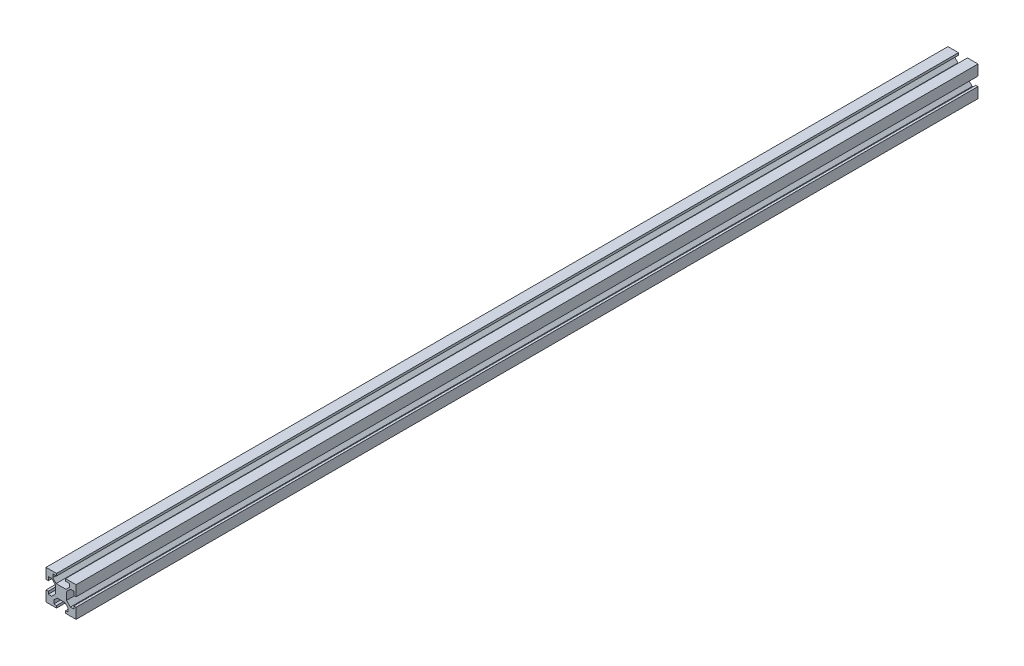
from build123d import *

# Parameters (mm, degrees)
BOSS_EXTRUDE1_DEPTH = 600


with BuildPart() as part:
    # Sketch1 → Boss-Extrude1 (new body)
    with BuildSketch(Plane.XY):
        Polygon((-10, 3), (-10, 10), (-3, 10), (-3, 8.5), (-5.5, 8.5), (-5.5, 6.207106781), (-3.292893219, 4), (3.292893219, 4), (5.5, 6.207106781), (5.5, 8.5), (3, 8.5), (3, 10), (10, 10), (10, 3), (8.5, 3), (8.5, 5.5), (6.207106781, 5.5), (3.645660172, 2.938553391), (3.645660172, -2.231446609), (6.207106781, -4.792893219), (8.5, -4.792893219), (8.5, -3), (10, -3), (10, -10), (3, -10), (3, -8.5), (4.792893219, -8.5), (4.792893219, -6.207106781), (2.585786438, -4), (-2.585786438, -4), (-4.792893219, -6.207106781), (-4.792893219, -8.5), (-3, -8.5), (-3, -10), (-10, -10), (-10, -3), (-8.5, -3), (-8.5, -4.792893219), (-6.207106781, -4.792893219), (-3.645660172, -2.231446609), (-3.645660172, 2.938553391), (-6.207106781, 5.5), (-8.5, 5.5), (-8.5, 3), align=None)
    extrude(amount=-BOSS_EXTRUDE1_DEPTH)


solid = part.part
